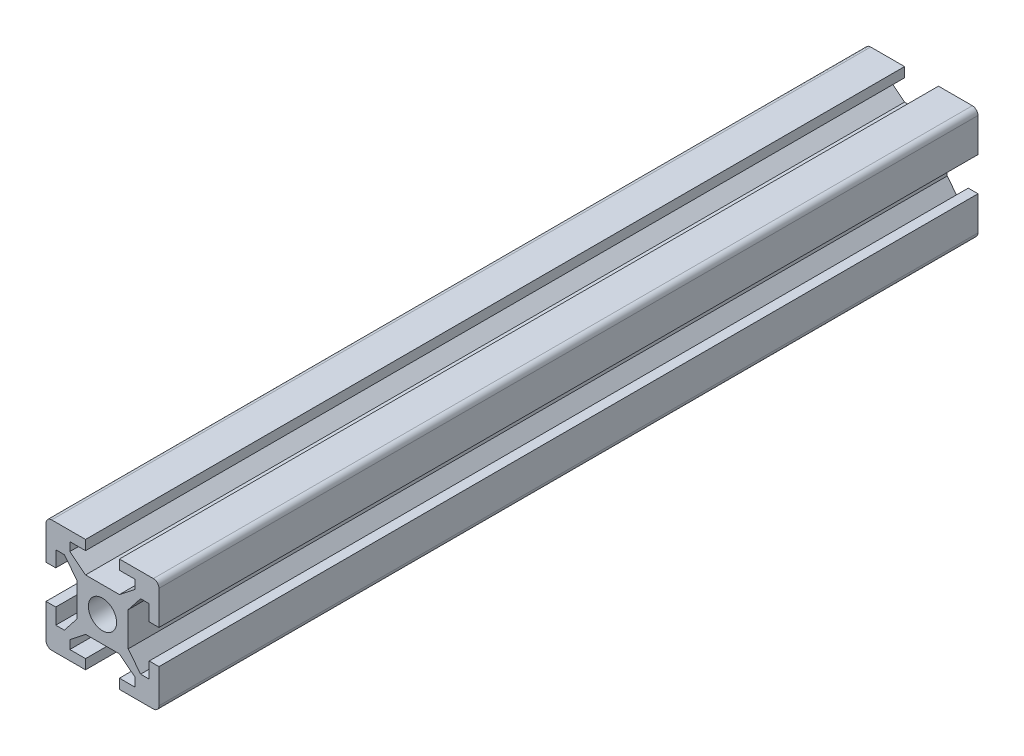
from build123d import *

# Parameters (mm, degrees)
BOSS_EXTRUDE1_DEPTH     = 72.5
CUT_EXTRUDE1_DEPTH      = 146.688022843
CUT_EXTRUDE1_DEPTH_BACK = 146.688022843
SKETCH2_R               = 2.5
FILLET1_R               = 1


with BuildPart() as part:
    # Sketch1 → Boss-Extrude1 (new, symmetric)
    with BuildSketch(Plane.XY):
        Polygon((-10, 10), (-3, 10), (-3, 8.272610059), (-5.783778863, 8.272610059), (-5.783778863, 6.747994248), (-3, 4.550753814), (3, 4.550753814), (5.783778863, 6.747994248), (5.783778863, 8.272610059), (3, 8.272610059), (3, 10), (10, 10), (10, 3), (8.272610059, 3), (8.272610059, 5.783778863), (6.747994248, 5.783778863), (4.55, 3.000595152), (4.55, -2.999404848), (6.747994248, -5.783778863), (8.272610059, -5.783778863), (8.272610059, -3), (10, -3), (10, -10), (3, -10), (3, -8.272610059), (5.783778863, -8.272610059), (5.783778863, -6.747994248), (2.999404848, -4.55), (-3.000595152, -4.55), (-5.783778863, -6.747994248), (-5.783778863, -8.272610059), (-3, -8.272610059), (-3, -10), (-10, -10), (-10, -3), (-8.272610059, -3), (-8.272610059, -5.783778863), (-6.747994248, -5.783778863), (-4.55, -3.000595152), (-4.55, 2.999404848), (-6.747994248, 5.783778863), (-8.272610059, 5.783778863), (-8.272610059, 3), (-10, 3), align=None)
    extrude(amount=BOSS_EXTRUDE1_DEPTH, both=True)

    # Sketch2 → Cut-Extrude1 (cut, two sides: drawn at the far end of the back side and taken through both)
    with BuildSketch(Plane.XY.offset(72.5).offset(-CUT_EXTRUDE1_DEPTH_BACK)):
        Circle(SKETCH2_R)
    extrude(amount=CUT_EXTRUDE1_DEPTH + CUT_EXTRUDE1_DEPTH_BACK, mode=Mode.SUBTRACT)

    # Fillet1
    fillet1_edges = [part.edges().sort_by_distance(p)[0] for p in [
        (-10, 10, 0),
        (10, 10, 0),
        (10, -10, 0),
        (-10, -10, 0),
    ]]
    fillet(fillet1_edges, radius=FILLET1_R)


solid = part.part
